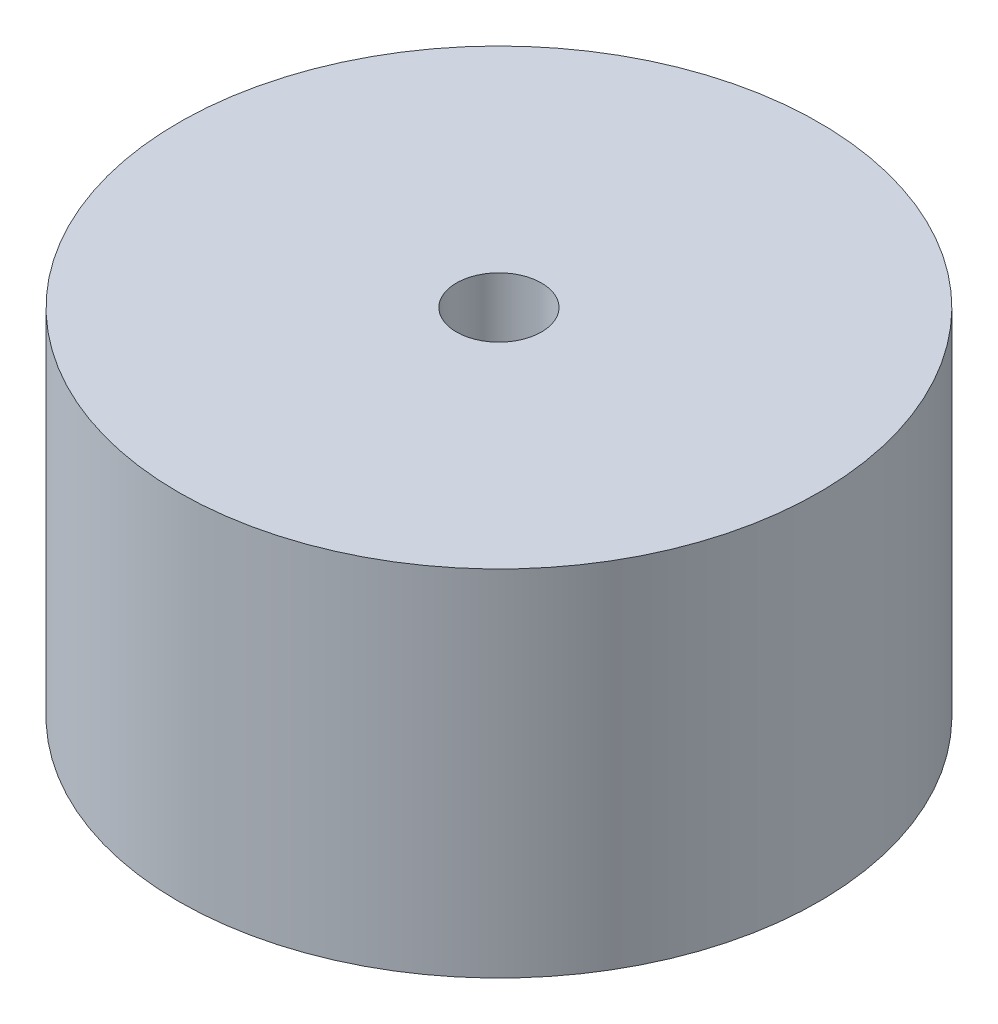
from build123d import *

# Parameters (mm, degrees)
SKETCH1_R           = 14.351
SKETCH1_R_2         = 1.905
BOSS_EXTRUDE1_DEPTH = 15.875


with BuildPart() as part:
    # Sketch1 → Boss-Extrude1 (new body)
    with BuildSketch(Plane(origin=(0, 0, 0), x_dir=(1, 0, 0), z_dir=(0, 1, 0))):
        with Locations(Location((0, 0, 0), (0, 0, 270))):
            Circle(SKETCH1_R)
        with Locations(Location((0, 0, 0), (0, 0, 270))):
            Circle(SKETCH1_R_2, mode=Mode.SUBTRACT)
    extrude(amount=BOSS_EXTRUDE1_DEPTH)


solid = part.part
